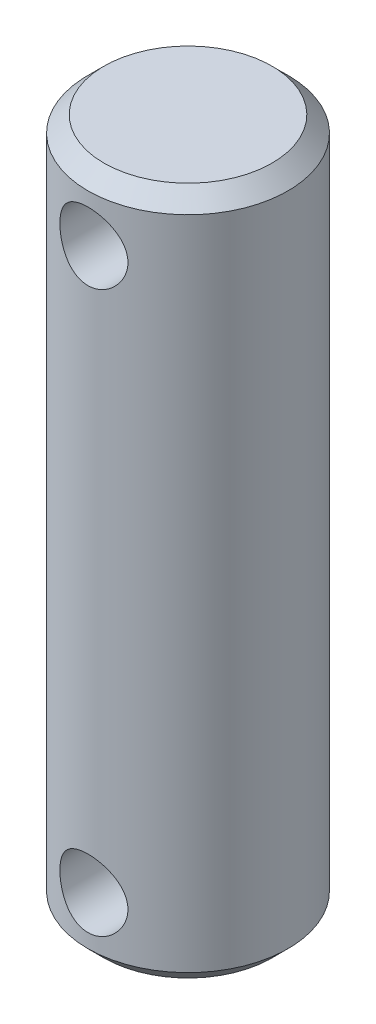
from build123d import *

# Parameters (mm, degrees)
ESBO_O1_R                = 12.5
RESSALTO_EXTRUS_O1_DEPTH = 43
CHANFRO1_SIZE            = 2
ESBO_O2_R                = 4.25
CORTE_EXTRUS_O1_DEPTH    = 43


with BuildPart() as part:
    # Esboço1 → Ressalto-extrusão1 (new, symmetric)
    with BuildSketch(Plane(origin=(0, 0, 0), x_dir=(1, 0, 0), z_dir=(0, 1, 0))):
        with Locations(Location((0, 0, 0), (0, 0, 270))):
            Circle(ESBO_O1_R)
    extrude(amount=RESSALTO_EXTRUS_O1_DEPTH, both=True)

    # Chanfro1
    chanfro1_edges = [part.edges().sort_by_distance(p)[0] for p in [
        (0, -43, -12.5),
        (0, 43, -12.5),
    ]]
    chamfer(chanfro1_edges, length=CHANFRO1_SIZE)

    # Esboço2 → Corte-extrusão1 (cut, symmetric)
    with BuildSketch(Plane.XY):
        with Locations(Location((0, 35, 0), (0, 0, 89.999999985))):
            Circle(ESBO_O2_R)
        with Locations(Location((0, -35, 0), (0, 0, 89.999999985))):
            Circle(ESBO_O2_R)
    extrude(amount=CORTE_EXTRUS_O1_DEPTH, both=True, mode=Mode.SUBTRACT)


solid = part.part
